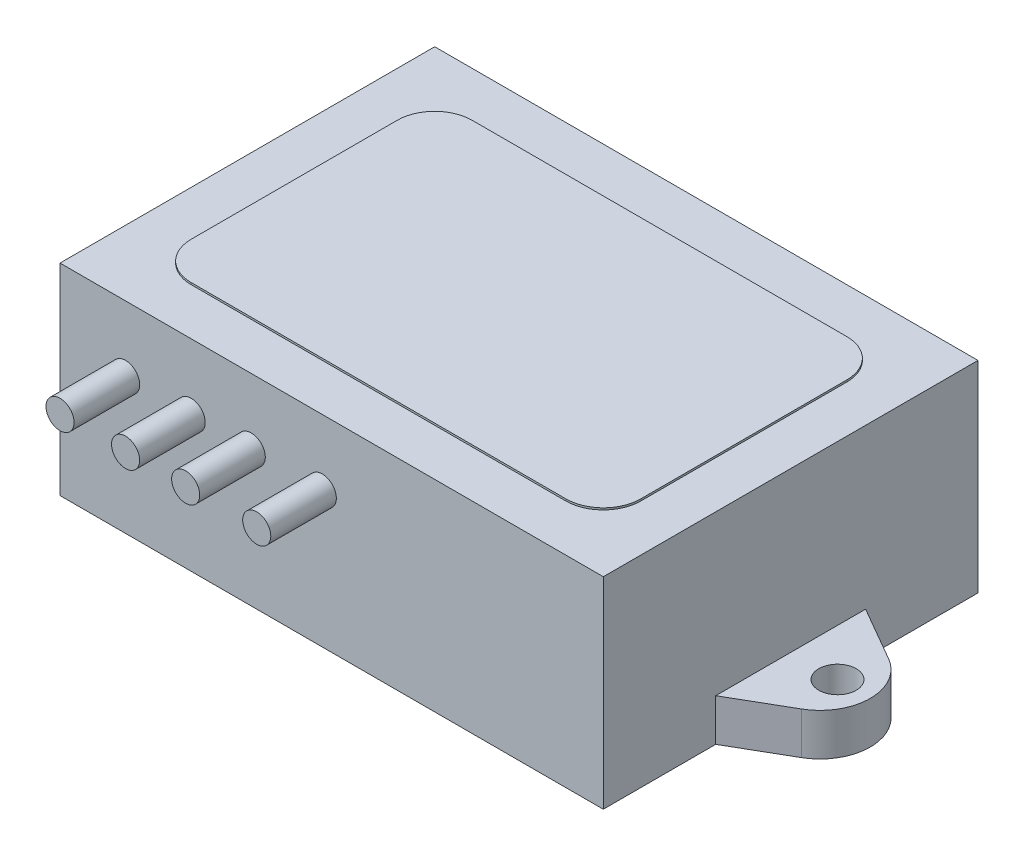
from build123d import *

# Parameters (mm, degrees)
SKETCH1_W           = 58
SKETCH1_H           = 40
BOSS_EXTRUDE1_DEPTH = 21.5
BOSS_EXTRUDE2_DEPTH = 4.5
SKETCH3_R           = 2
CUT_EXTRUDE1_DEPTH  = 80.443376061
BOSS_EXTRUDE3_DEPTH = 0.2
SKETCH6_R           = 1.5
BOSS_EXTRUDE4_DEPTH = 7
SKETCH8_R           = 1.5
BOSS_EXTRUDE6_DEPTH = 7
SKETCH9_R           = 1.5
BOSS_EXTRUDE7_DEPTH = 7


with BuildPart() as part:
    # Sketch1 → Boss-Extrude1 (new body)
    with BuildSketch(Plane(origin=(0, 0, 0), x_dir=(1, 0, 0), z_dir=(0, 1, 0))):
        with Locations((29, 20)):
            Rectangle(SKETCH1_W, SKETCH1_H)
    extrude(amount=BOSS_EXTRUDE1_DEPTH)

    # Sketch2 → Boss-Extrude2 (add)
    with BuildSketch(Plane(origin=(0, 0, 0), x_dir=(1, 0, 0), z_dir=(0, 1, 0))):
        with BuildLine():
            Line((0, 28), (0, 12))
            Line((0, 12), (-5.82179677, 15.361215932))
            ThreePointArc((-5.82179677, 15.361215932), (-8.5, 20), (-5.82179677, 24.638784068))
            Line((-5.82179677, 24.638784068), (0, 28))
        make_face()
        with BuildLine():
            Line((58, 28), (63.82179677, 24.638784068))
            ThreePointArc((63.82179677, 24.638784068), (66.5, 20), (63.82179677, 15.361215932))
            Line((63.82179677, 15.361215932), (58, 12))
            Line((58, 12), (58, 28))
        make_face()
    extrude(amount=BOSS_EXTRUDE2_DEPTH)

    # Sketch3 → Cut-Extrude1 (cut, through all)
    with BuildSketch(Plane(origin=(0, 4.5, 0), x_dir=(1, 0, 0), z_dir=(0, 1, 0))):
        with Locations(Location((-5, 20, 0), (0, 0, 270))):
            Circle(SKETCH3_R)
        with Locations(Location((63, 20, 0), (0, 0, 90))):
            Circle(SKETCH3_R)
    extrude(amount=-CUT_EXTRUDE1_DEPTH, mode=Mode.SUBTRACT)

    # Sketch4 → Boss-Extrude3 (add)
    with BuildSketch(Plane(origin=(0, 21.5, 0), x_dir=(1, 0, 0), z_dir=(0, 1, 0))):
        with BuildLine():
            Line((5, 31), (5, 9))
            ThreePointArc((5, 9), (6.171572875, 6.171572875), (9, 5))
            Line((9, 5), (49, 5))
            ThreePointArc((49, 5), (51.828427125, 6.171572875), (53, 9))
            Line((53, 9), (53, 31))
            ThreePointArc((53, 31), (51.828427125, 33.828427125), (49, 35))
            Line((49, 35), (9, 35))
            ThreePointArc((9, 35), (6.171572875, 33.828427125), (5, 31))
        make_face()
    extrude(amount=BOSS_EXTRUDE3_DEPTH)

    # Sketch6 → Boss-Extrude4 (add)
    with BuildSketch(Plane.XY):
        with Locations((7, 14.5)):
            Circle(SKETCH6_R)
    extrude(amount=BOSS_EXTRUDE4_DEPTH)

    # Sketch8 → Boss-Extrude6 (add)
    with BuildSketch(Plane.XY):
        with Locations(Location((14, 14.5, 0), (0, 0, 180))):
            Circle(SKETCH8_R)
        with Locations(Location((28, 14.5, 0), (0, 0, 180))):
            Circle(SKETCH8_R)
    extrude(amount=BOSS_EXTRUDE6_DEPTH)

    # Sketch9 → Boss-Extrude7 (add)
    with BuildSketch(Plane.XY):
        with Locations(Location((20.412696723, 14.5, 0), (0, 0, 180))):
            Circle(SKETCH9_R)
    extrude(amount=BOSS_EXTRUDE7_DEPTH)


solid = part.part
